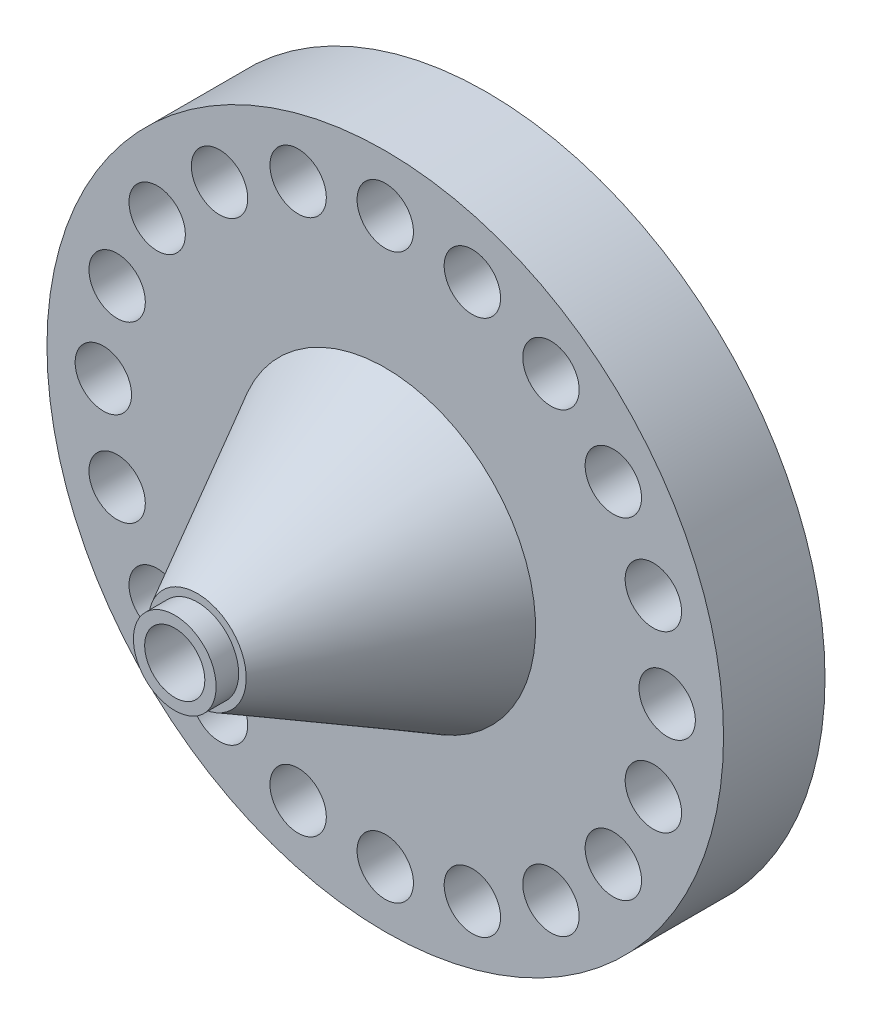
from build123d import *

# Parameters (mm, degrees)
SKETCH1_R           = 45
SKETCH1_R_2         = 3.75
BOSS_EXTRUDE1_DEPTH = 6.75
SKETCH3_R           = 6.5
SKETCH2_R           = 20
SKETCH5_R           = 5.5
BOSS_EXTRUDE2_DEPTH = 3
SKETCH6_R           = 4
CUT_EXTRUDE2_DEPTH  = 76.975324942
SKETCH8_R           = 6
CUT_EXTRUDE3_DEPTH  = 2


with BuildPart() as part:
    # Sketch1 → Boss-Extrude1 (new, symmetric)
    with BuildSketch(Plane.XY):
        Circle(SKETCH1_R)
        with Locations((0, 37.5)):
            Circle(SKETCH1_R_2, mode=Mode.SUBTRACT)
        with Locations((11.588137289, 35.664619361)):
            Circle(SKETCH1_R_2, mode=Mode.SUBTRACT)
        with Locations((22.041946961, 30.338137289)):
            Circle(SKETCH1_R_2, mode=Mode.SUBTRACT)
        with Locations((30.338137289, 22.041946961)):
            Circle(SKETCH1_R_2, mode=Mode.SUBTRACT)
        with Locations((35.664619361, 11.588137289)):
            Circle(SKETCH1_R_2, mode=Mode.SUBTRACT)
        with Locations((37.5, 0)):
            Circle(SKETCH1_R_2, mode=Mode.SUBTRACT)
        with Locations((35.664619361, -11.588137289)):
            Circle(SKETCH1_R_2, mode=Mode.SUBTRACT)
        with Locations((30.338137289, -22.041946961)):
            Circle(SKETCH1_R_2, mode=Mode.SUBTRACT)
        with Locations((22.041946961, -30.338137289)):
            Circle(SKETCH1_R_2, mode=Mode.SUBTRACT)
        with Locations((11.588137289, -35.664619361)):
            Circle(SKETCH1_R_2, mode=Mode.SUBTRACT)
        with Locations((0, -37.5)):
            Circle(SKETCH1_R_2, mode=Mode.SUBTRACT)
        with Locations((-11.588137289, -35.664619361)):
            Circle(SKETCH1_R_2, mode=Mode.SUBTRACT)
        with Locations((-22.041946961, -30.338137289)):
            Circle(SKETCH1_R_2, mode=Mode.SUBTRACT)
        with Locations((-30.338137289, -22.041946961)):
            Circle(SKETCH1_R_2, mode=Mode.SUBTRACT)
        with Locations((-35.664619361, -11.588137289)):
            Circle(SKETCH1_R_2, mode=Mode.SUBTRACT)
        with Locations((-37.5, 0)):
            Circle(SKETCH1_R_2, mode=Mode.SUBTRACT)
        with Locations((-35.664619361, 11.588137289)):
            Circle(SKETCH1_R_2, mode=Mode.SUBTRACT)
        with Locations((-30.338137289, 22.041946961)):
            Circle(SKETCH1_R_2, mode=Mode.SUBTRACT)
        with Locations((-22.041946961, 30.338137289)):
            Circle(SKETCH1_R_2, mode=Mode.SUBTRACT)
        with Locations((-11.588137289, 35.664619361)):
            Circle(SKETCH1_R_2, mode=Mode.SUBTRACT)
    extrude(amount=BOSS_EXTRUDE1_DEPTH, both=True)

    # Sketch3 → Loft1 section 0
    with BuildSketch(Plane.XY.offset(31.75)):
        Circle(SKETCH3_R)
    # Sketch2 → Loft1 section 1
    with BuildSketch(Plane.XY.offset(6.75)):
        Circle(SKETCH2_R)
    loft()

    # Sketch5 → Boss-Extrude2 (add)
    with BuildSketch(Plane.XY.offset(31.75)):
        Circle(SKETCH5_R)
    extrude(amount=BOSS_EXTRUDE2_DEPTH)

    # Sketch6 → Cut-Extrude2 (cut, through all)
    with BuildSketch(Plane.XY.offset(34.75)):
        Circle(SKETCH6_R)
    extrude(amount=-CUT_EXTRUDE2_DEPTH, mode=Mode.SUBTRACT)

    # Sketch8 → Cut-Extrude3 (cut)
    with BuildSketch(Plane(origin=(0, 0, -6.75), x_dir=(-1, 0, 0), z_dir=(0, 0, -1))):
        Circle(SKETCH8_R)
    extrude(amount=-CUT_EXTRUDE3_DEPTH, mode=Mode.SUBTRACT)


solid = part.part
